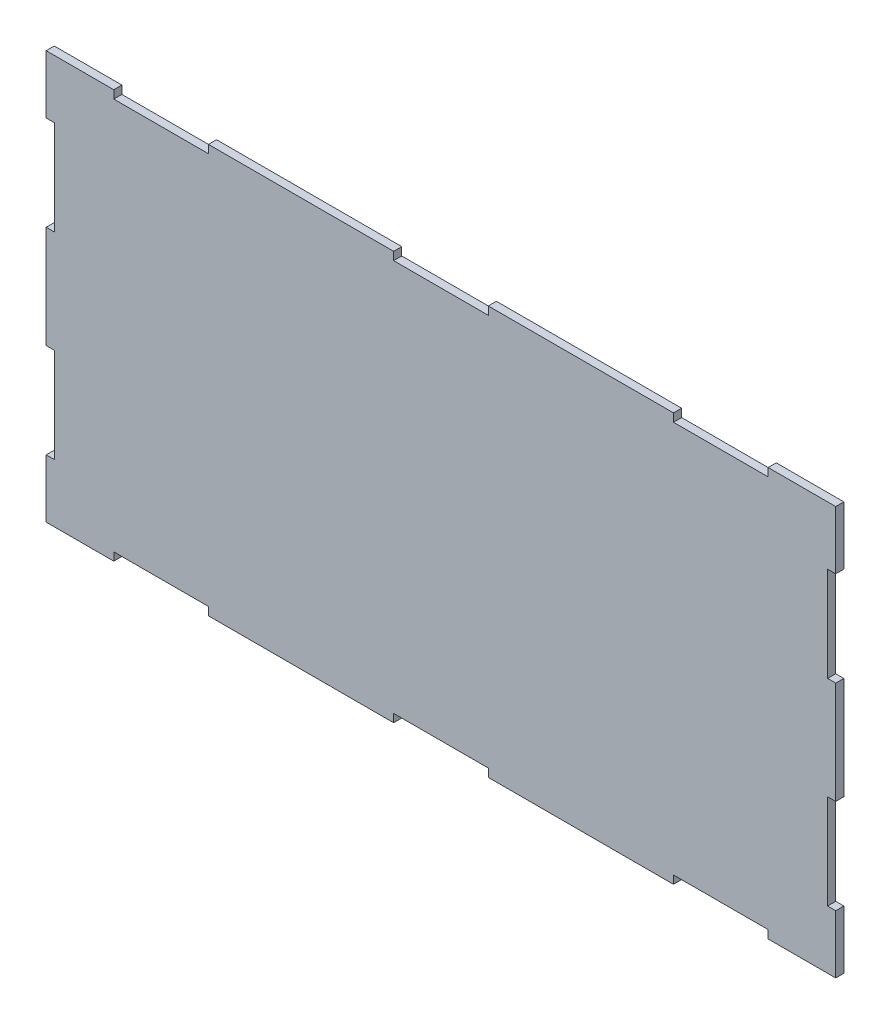
from build123d import *

# Parameters (mm, degrees)
SKETCH1_W           = 292
SKETCH1_H           = 151
BOSS_EXTRUDE1_DEPTH = 3
SKETCH2_W           = 35
SKETCH2_H           = 3
CUT_EXTRUDE1_DEPTH  = 3
SKETCH4_W           = 35
SKETCH4_H           = 3
CUT_EXTRUDE2_DEPTH  = 3
SKETCH5_W           = 3
SKETCH5_H           = 35
CUT_EXTRUDE3_DEPTH  = 3
SKETCH7_W           = 3
SKETCH7_H           = 35
CUT_EXTRUDE4_DEPTH  = 3


with BuildPart() as part:
    # Sketch1 → Boss-Extrude1 (new body)
    with BuildSketch(Plane.XY):
        Rectangle(SKETCH1_W, SKETCH1_H)
    extrude(amount=BOSS_EXTRUDE1_DEPTH)

    # Sketch2 → Cut-Extrude1 (cut)
    with BuildSketch(Plane.XY.offset(3)):
        with Locations((103.5, 74)):
            Rectangle(SKETCH2_W, SKETCH2_H)
        with Locations((-103.5, 74)):
            Rectangle(SKETCH2_W, SKETCH2_H)
        with Locations((-103.5, -74)):
            Rectangle(SKETCH2_W, SKETCH2_H)
        with Locations((103.5, -74)):
            Rectangle(SKETCH2_W, SKETCH2_H)
    extrude(amount=-CUT_EXTRUDE1_DEPTH, mode=Mode.SUBTRACT)

    # Sketch4 → Cut-Extrude2 (cut)
    with BuildSketch(Plane.XY):
        with Locations((0, -74)):
            Rectangle(SKETCH4_W, SKETCH4_H)
        with Locations((0, 74)):
            Rectangle(SKETCH4_W, SKETCH4_H)
    extrude(amount=CUT_EXTRUDE2_DEPTH, mode=Mode.SUBTRACT)

    # Sketch5 → Cut-Extrude3 (cut)
    with BuildSketch(Plane(origin=(146, 0, 0), x_dir=(0, 0, -1), z_dir=(1, 0, 0))):
        with Locations((-1.5, -36.45)):
            Rectangle(SKETCH5_W, SKETCH5_H)
        with Locations((-1.5, 36.45)):
            Rectangle(SKETCH5_W, SKETCH5_H)
    extrude(amount=-CUT_EXTRUDE3_DEPTH, mode=Mode.SUBTRACT)

    # Sketch7 → Cut-Extrude4 (cut)
    with BuildSketch(Plane.ZY.offset(146)):
        with Locations((1.5, -36.45)):
            Rectangle(SKETCH7_W, SKETCH7_H)
        with Locations((1.5, 36.45)):
            Rectangle(SKETCH7_W, SKETCH7_H)
    extrude(amount=-CUT_EXTRUDE4_DEPTH, mode=Mode.SUBTRACT)


solid = part.part
